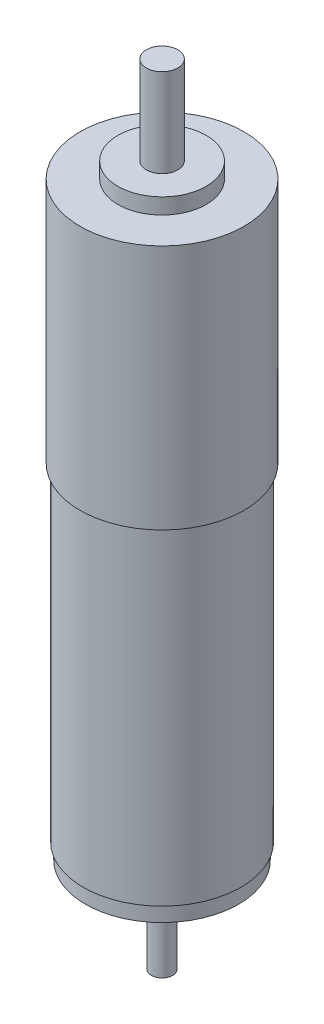
from build123d import *

# Parameters (mm, degrees)
ESQUISSE2_R        = 1.692758077
BOSS_EXTRU_1_DEPTH = 15
ESQUISSE3_R        = 4
BOSS_EXTRU_2_DEPTH = 2.5


with BuildPart() as part:
    # Esquisse1 → Révolution1 (revolve)
    with BuildSketch(Plane.XY, mode=Mode.PRIVATE) as r_volution1_sk:
        Polygon((0, 0), (12.15, 0), (12.15, 2.5), (12.5, 2.5), (12.5, 54.5), (13, 54.5), (13, 93.5), (7, 93.5), (7, 96), (2.5, 96), (2.5, 110), (0, 110), align=None)
    revolve(r_volution1_sk.sketch.rotate(Axis((0, 0, 0), (0, 1, 0)), 90), axis=Axis((0, 0, 0), (0, 1, 0)))

    # Esquisse2 → Boss.-Extru.1 (add)
    with BuildSketch(Plane.XZ):
        with Locations(Location((0, 0, 0), (0, 0, 270))):
            Circle(ESQUISSE2_R)
    extrude(amount=BOSS_EXTRU_1_DEPTH)

    # Esquisse3 → Boss.-Extru.2 (add)
    with BuildSketch(Plane.XZ):
        with Locations(Location((0, 0, 0), (0, 0, 270))):
            Circle(ESQUISSE3_R)
    extrude(amount=BOSS_EXTRU_2_DEPTH)


solid = part.part
